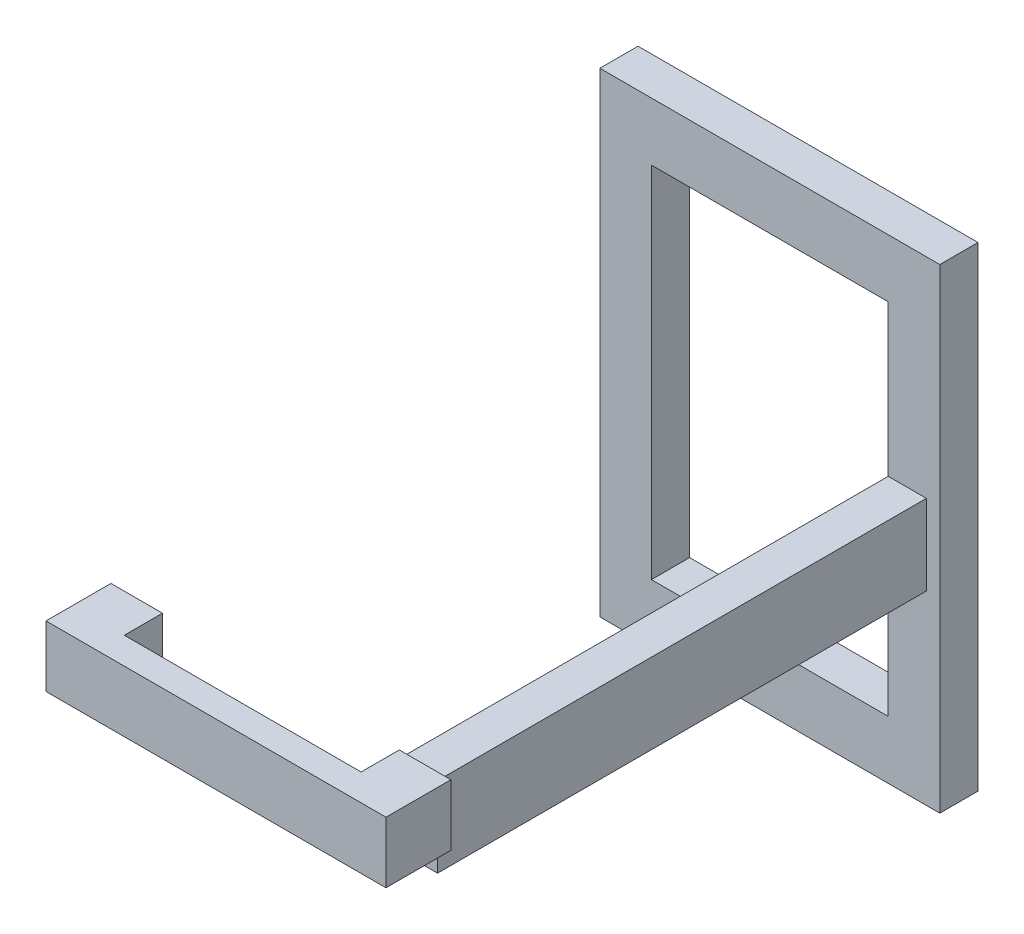
from build123d import *

# Parameters (mm, degrees)
SKETCH1_W           = 89.004906374
SKETCH1_H           = 124.399859706
SKETCH1_W_2         = 61.999445932
SKETCH1_H_2         = 93.995967372
BOSS_EXTRUDE1_DEPTH = 10
SKETCH2_W           = 9.996534877
SKETCH2_H           = 20.999060591
BOSS_EXTRUDE2_DEPTH = 128
SKETCH3_W           = 89.004906374
SKETCH3_H           = 124.399859706
SKETCH3_W_2         = 61.999445932
SKETCH3_H_2         = 93.995967372
BOSS_EXTRUDE3_DEPTH = 17
SKETCH4_W           = 61.999445932
SKETCH4_H           = 16.009834455
BOSS_EXTRUDE4_DEPTH = 7
SKETCH5_W           = 89.004906374
SKETCH5_H           = 55.583620716
SKETCH5_H_2         = 52.806404535
CUT_EXTRUDE1_DEPTH  = 17


with BuildPart() as part:
    # Sketch1 → Boss-Extrude1 (new body)
    with BuildSketch(Plane.XY):
        Rectangle(SKETCH1_W, SKETCH1_H)
        Rectangle(SKETCH1_W_2, SKETCH1_H_2, mode=Mode.SUBTRACT)
    extrude(amount=BOSS_EXTRUDE1_DEPTH)

    # Sketch2 → Boss-Extrude2 (add)
    with BuildSketch(Plane.XY.offset(10)):
        with Locations((35.997990405, -3.066392871)):
            Rectangle(SKETCH2_W, SKETCH2_H)
    extrude(amount=BOSS_EXTRUDE2_DEPTH)

    # Sketch3 → Boss-Extrude3 (add)
    with BuildSketch(Plane.XY.offset(138)):
        Rectangle(SKETCH3_W, SKETCH3_H)
        Rectangle(SKETCH3_W_2, SKETCH3_H_2, mode=Mode.SUBTRACT)
    extrude(amount=BOSS_EXTRUDE3_DEPTH)

    # Sketch4 → Boss-Extrude4 (add)
    with BuildSketch(Plane.XY.offset(155)):
        with Locations((0, 1.388608091)):
            Rectangle(SKETCH4_W, SKETCH4_H)
    extrude(amount=-BOSS_EXTRUDE4_DEPTH)

    # Sketch5 → Cut-Extrude1 (cut)
    with BuildSketch(Plane.XY.offset(155)):
        with Locations((0, -34.408119495)):
            Rectangle(SKETCH5_W, SKETCH5_H)
        with Locations((0, 35.796727586)):
            Rectangle(SKETCH5_W, SKETCH5_H_2)
    extrude(amount=-CUT_EXTRUDE1_DEPTH, mode=Mode.SUBTRACT)


solid = part.part
